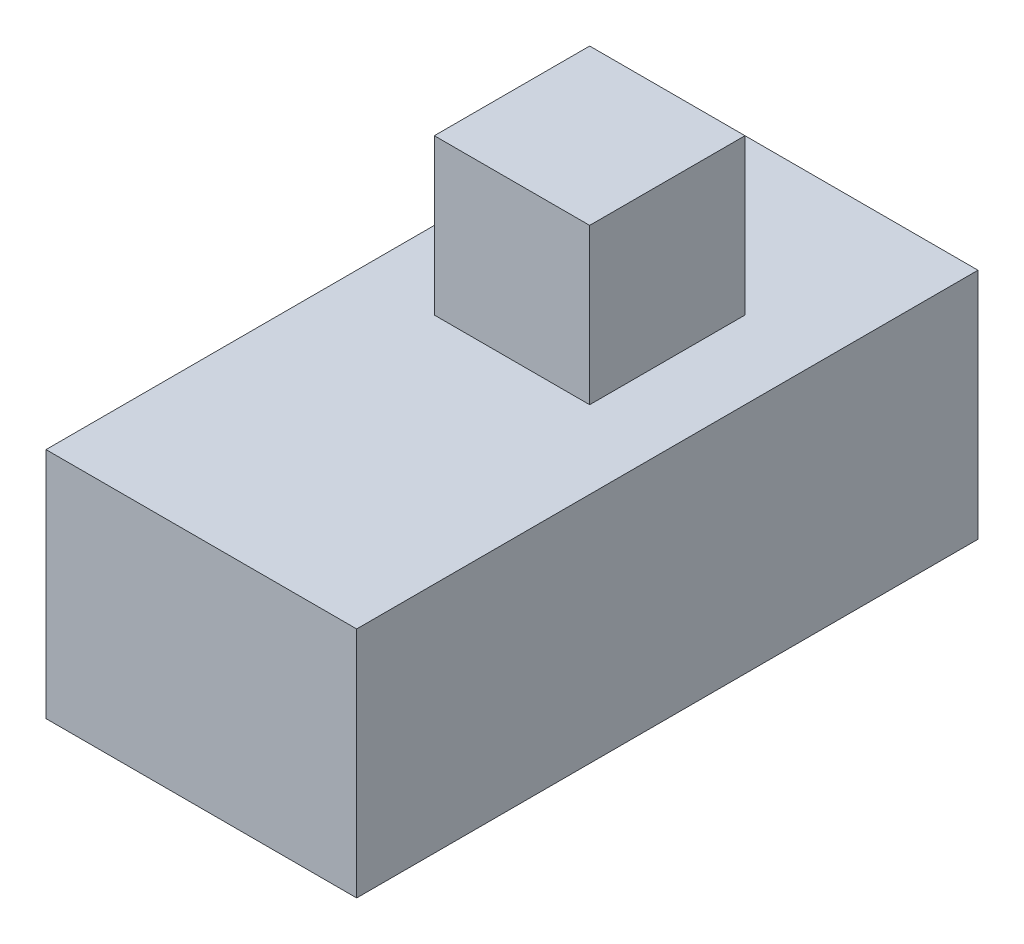
from build123d import *

# Parameters (mm, degrees)
SKETCH1_W           = 4
SKETCH1_H           = 8
BOSS_EXTRUDE1_DEPTH = 3
SKETCH3_W           = 2
SKETCH3_H           = 2
BOSS_EXTRUDE2_DEPTH = 2


with BuildPart() as part:
    # Sketch1 → Boss-Extrude1 (new body)
    with BuildSketch(Plane(origin=(0, 0, 0), x_dir=(1, 0, 0), z_dir=(0, 1, 0))):
        with Locations((2, -4)):
            Rectangle(SKETCH1_W, SKETCH1_H)
    extrude(amount=BOSS_EXTRUDE1_DEPTH)

    # Sketch3 → Boss-Extrude2 (add)
    with BuildSketch(Plane(origin=(0, 3, 0), x_dir=(1, 0, 0), z_dir=(0, 1, 0))):
        with Locations((2, -3)):
            Rectangle(SKETCH3_W, SKETCH3_H)
    extrude(amount=BOSS_EXTRUDE2_DEPTH)


solid = part.part
